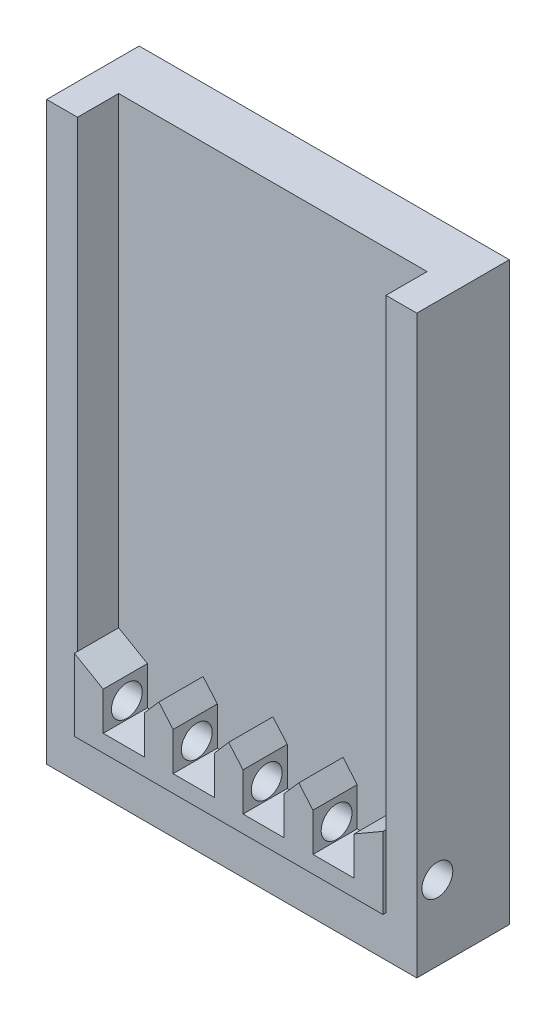
from build123d import *

# Parameters (mm, degrees)
ESBO_O1_W                = 15
ESBO_O1_H                = 26
RESSALTO_EXTRUS_O1_DEPTH = 2.5
RESSALTO_EXTRUS_O2_DEPTH = 4.5
RESSALTO_EXTRUS_O3_DEPTH = 2.15
ESBO_O3_R                = 0.75
CORTE_EXTRUS_O1_DEPTH    = 34.609857185


with BuildPart() as part:
    # Esboço1 → Ressalto-extrusão1 (new body)
    with BuildSketch(Plane.XY):
        with Locations((9, 15)):
            Rectangle(ESBO_O1_W, ESBO_O1_H)
    extrude(amount=RESSALTO_EXTRUS_O1_DEPTH)

    # Esboço1<3> → Ressalto-extrusão2 (add)
    with BuildSketch(Plane.XY):
        Polygon((1.5, 2), (1.5, 28), (0, 28), (0, 0), (18, 0), (18, 28), (16.5, 28), (16.5, 2), align=None)
    extrude(amount=RESSALTO_EXTRUS_O2_DEPTH)

    # Esboço2 → Ressalto-extrusão3 (add)
    with BuildSketch(Plane.XY.offset(2.5)):
        Polygon((1.5, 2), (1.5, 5.5), (2.9, 4.691709623), (2.9, 2.829578102), (4.9, 2.829578102), (4.9, 4.691709623), (5.605720556, 5.5), (6.3, 4.691709623), (6.3, 2.829578102), (8.3, 2.829578102), (8.3, 4.691709623), (9, 5.5), (9.7, 4.691709623), (9.7, 2.829578102), (11.7, 2.829578102), (11.7, 4.691709623), (12.412546272, 5.5), (13.1, 4.691709623), (13.1, 2.829578102), (15.1, 2.829578102), (15.1, 4.691709623), (16.5, 5.5), (16.5, 2), align=None)
    extrude(amount=RESSALTO_EXTRUS_O3_DEPTH)

    # Esboço3 → Corte-extrusão1 (cut, through all)
    with BuildSketch(Plane(origin=(18, 0, 0), x_dir=(0, 0, -1), z_dir=(1, 0, 0))):
        with Locations((-3.5, 3.633303465)):
            Circle(ESBO_O3_R)
    extrude(amount=-CORTE_EXTRUS_O1_DEPTH, mode=Mode.SUBTRACT)


solid = part.part
